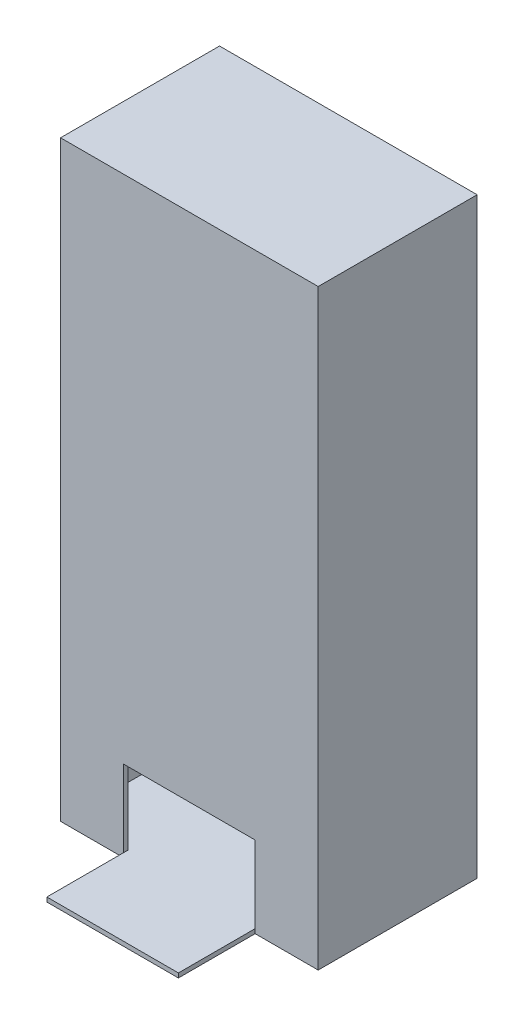
from build123d import *

# Parameters (mm, degrees)
ESQUISSE1_W             = 235
ESQUISSE1_H             = 540
BOSS_EXTRU_1_DEPTH      = 145
ESQUISSE2_W             = 227
ESQUISSE2_H             = 532
ENL_V_MAT_EXTRU_1_DEPTH = 141
ESQUISSE3_W             = 235
ESQUISSE3_H             = 540
BOSS_EXTRU_2_DEPTH      = 4
ESQUISSE4_W             = 120
ESQUISSE4_H             = 70
ENL_V_MAT_EXTRU_2_DEPTH = 4
ESQUISSE5_W             = 120
ESQUISSE5_H             = 4
BOSS_EXTRU_3_DEPTH      = 70


with BuildPart() as part:
    # Esquisse1 → Boss.-Extru.1 (new body)
    with BuildSketch(Plane.XY):
        with Locations((117.5, -270)):
            Rectangle(ESQUISSE1_W, ESQUISSE1_H)
    extrude(amount=BOSS_EXTRU_1_DEPTH)

    # Esquisse2 → Enlèv. mat.-Extru.1 (cut)
    with BuildSketch(Plane.XY.offset(145)):
        with Locations((117.5, -270)):
            Rectangle(ESQUISSE2_W, ESQUISSE2_H)
    extrude(amount=-ENL_V_MAT_EXTRU_1_DEPTH, mode=Mode.SUBTRACT)

    # Esquisse3 → Boss.-Extru.2 (add)
    with BuildSketch(Plane.XY.offset(145)):
        with Locations((117.5, -270)):
            Rectangle(ESQUISSE3_W, ESQUISSE3_H)
    extrude(amount=-BOSS_EXTRU_2_DEPTH)

    # Esquisse4 → Enlèv. mat.-Extru.2 (cut)
    with BuildSketch(Plane.XY.offset(145)):
        with Locations((117.5, -501)):
            Rectangle(ESQUISSE4_W, ESQUISSE4_H)
    extrude(amount=-ENL_V_MAT_EXTRU_2_DEPTH, mode=Mode.SUBTRACT)

    # Esquisse5 → Boss.-Extru.3 (add)
    with BuildSketch(Plane.XY.offset(145)):
        with Locations((117.5, -538)):
            Rectangle(ESQUISSE5_W, ESQUISSE5_H)
    extrude(amount=BOSS_EXTRU_3_DEPTH)


solid = part.part
